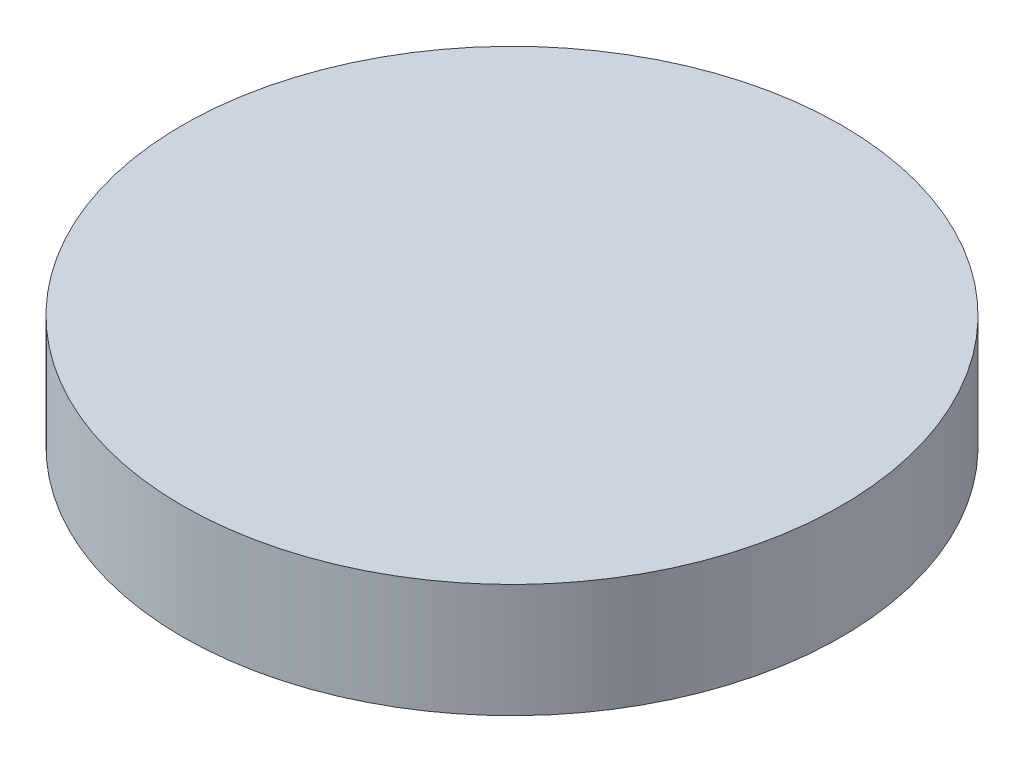
from build123d import *

# Parameters (mm, degrees)
SKETCH_1_R      = 145
EXTRUDE_1_DEPTH = 50


with BuildPart() as part:
    # 草图1 → 凸台-拉伸1 (new body)
    with BuildSketch(Plane(origin=(0, 0, 0), x_dir=(1, 0, 0), z_dir=(0, 1, 0))):
        with Locations(Location((0, 0, 0), (0, 0, 270))):
            Circle(SKETCH_1_R)
    extrude(amount=EXTRUDE_1_DEPTH)


solid = part.part
